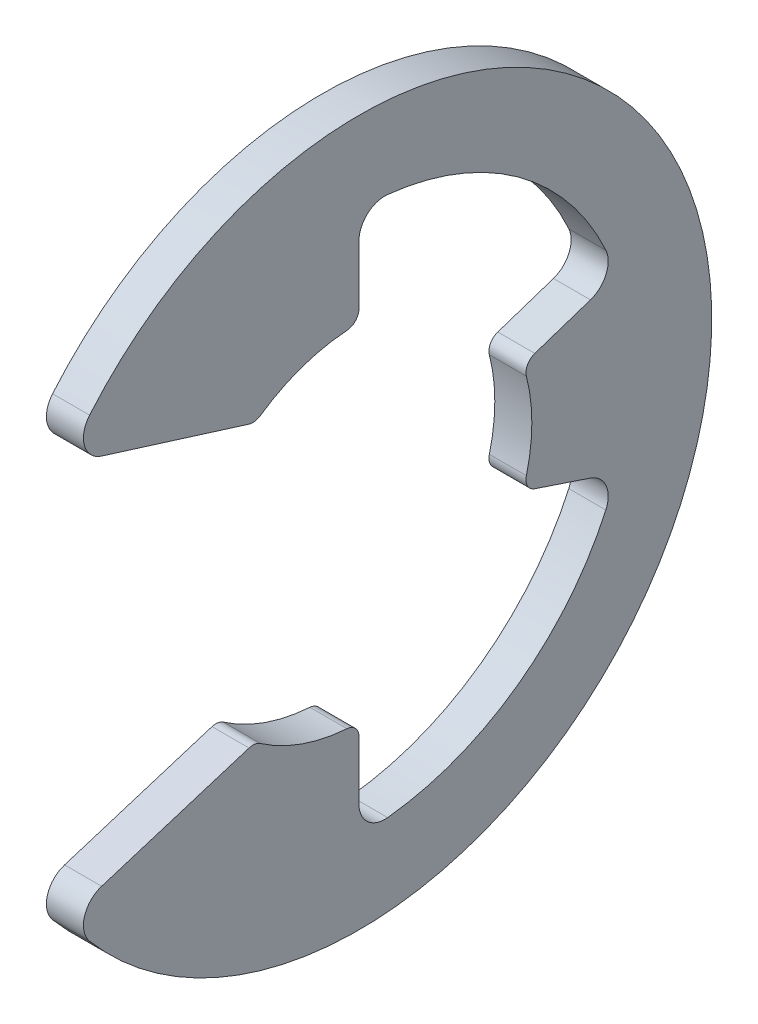
from build123d import *

# Parameters (mm, degrees)
BOSS_EXTRUDE1_DEPTH      = 0.5334
BOSS_EXTRUDE1_DEPTH_BACK = 0.5334
FILLET1_R                = 0.74676
FILLET2_R                = 0.37338


with BuildPart() as part:
    # Sketch3 → Boss-Extrude1 (new, two sides: drawn at the far end of the back side and taken through both)
    with BuildSketch(Plane(origin=(0, 0, 0), x_dir=(0, 0, -1), z_dir=(1, 0, 0)).offset(-BOSS_EXTRUDE1_DEPTH_BACK)):
        with BuildLine():
            Line((4.722924931, -1.57430831), (7.412411478, -2.470803826))
            ThreePointArc((7.412411478, -2.470803826), (4.568556477, -6.338533521), (0, -7.813367742))
            Line((0, -7.813367742), (0, -4.9784))
            ThreePointArc((0, -4.9784), (-1.57430831, -4.722924931), (-2.98704, -3.98272))
            Line((-2.98704, -3.98272), (-8.423359932, -5.680898473))
            ThreePointArc((-8.423359932, -5.680898473), (10.16, 0), (-8.423359932, 5.680898473))
            Line((-8.423359932, 5.680898473), (-2.98704, 3.98272))
            ThreePointArc((-2.98704, 3.98272), (-1.57430831, 4.722924931), (0, 4.9784))
            Line((0, 4.9784), (0, 7.813367742))
            ThreePointArc((0, 7.813367742), (4.568556477, 6.338533521), (7.412411478, 2.470803826))
            Line((7.412411478, 2.470803826), (4.722924931, 1.57430831))
            ThreePointArc((4.722924931, 1.57430831), (4.9784, 0), (4.722924931, -1.57430831))
        make_face()
    extrude(amount=BOSS_EXTRUDE1_DEPTH + BOSS_EXTRUDE1_DEPTH_BACK)

    # Fillet1
    fillet1_edges = [part.edges().sort_by_distance(p)[0] for p in [
        (0, 2.470803826, -7.412411478),
        (0, 7.813367742, 0),
        (0, 5.680898473, 8.423359932),
        (0, -5.680898473, 8.423359932),
        (0, -7.813367742, 0),
        (0, -2.470803826, -7.412411478),
    ]]
    fillet(fillet1_edges, radius=FILLET1_R)

    # Fillet2
    fillet2_edges = [part.edges().sort_by_distance(p)[0] for p in [
        (0, 1.57430831, -4.722924931),
        (0, 4.9784, 0),
        (0, 3.98272, 2.98704),
        (0, -3.98272, 2.98704),
        (0, -4.9784, 0),
        (0, -1.57430831, -4.722924931),
    ]]
    fillet(fillet2_edges, radius=FILLET2_R)


solid = part.part
